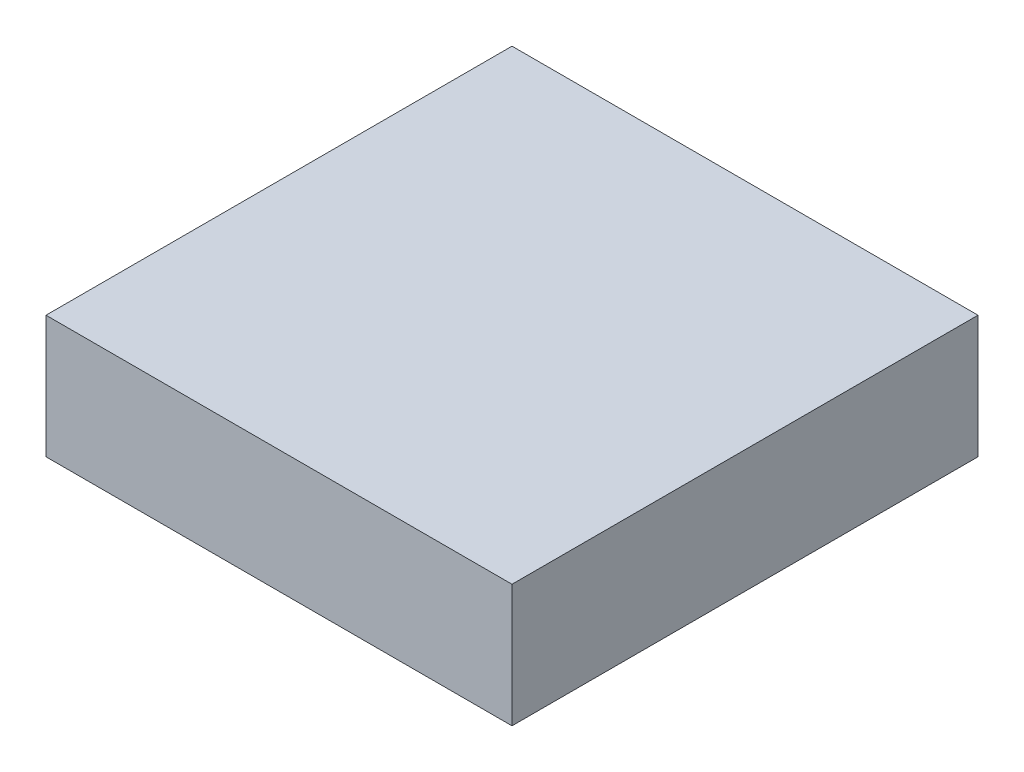
from build123d import *

# Parameters (mm, degrees)
SKETCH1_W           = 57
SKETCH1_H           = 57
BOSS_EXTRUDE1_DEPTH = 15


with BuildPart() as part:
    # Sketch1 → Boss-Extrude1 (new body)
    with BuildSketch(Plane(origin=(0, 0, 0), x_dir=(1, 0, 0), z_dir=(0, 1, 0))):
        Rectangle(SKETCH1_W, SKETCH1_H)
    extrude(amount=BOSS_EXTRUDE1_DEPTH)


solid = part.part
